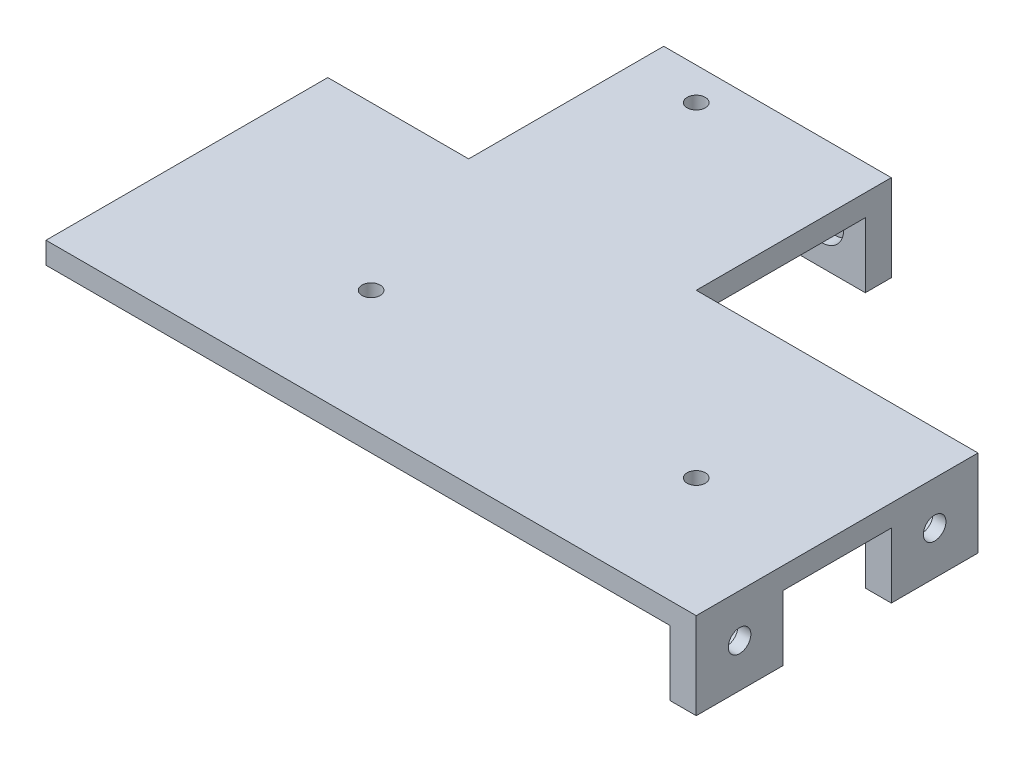
from build123d import *
from build123d.topology import SkipClean

# Parameters (mm, degrees)
SKETCH_1_R          = 2.1
EXTRUDE_1_DEPTH     = 5
SKETCH_2_W          = 20
SKETCH_2_H          = 20
SKETCH_2_R          = 2.6
EXTRUDE_2_DEPTH     = 6
SKETCH_3_R          = 5
CUT_EXTRUDE_1_DEPTH = 3
SKETCH_5_W          = 20
SKETCH_5_H          = 20
SKETCH_5_R          = 2.6
EXTRUDE_3_DEPTH     = 6
SKETCH_6_R          = 5
CUT_EXTRUDE_2_DEPTH = 3
SKETCH_7_W          = 20
SKETCH_7_H          = 20
SKETCH_7_R          = 2.6
EXTRUDE_4_DEPTH     = 6
SKETCH_8_R          = 5
CUT_EXTRUDE_3_DEPTH = 3
EXTRUDE_START       = 7.6
SKETCH_9_R          = 5
SKETCH_9_R_2        = 2.1
EXTRUDE_5_DEPTH     = 7.6
EXTRUDE_START_2     = 2.5
SKETCH_10_R         = 5
SKETCH_10_R_2       = 3.95
EXTRUDE_6_DEPTH     = 2.5


with BuildPart() as part:
    # 草图1 → 凸台-拉伸1 (new body)
    with BuildSketch(Plane(origin=(0, 0, 0), x_dir=(1, 0, 0), z_dir=(0, 1, 0))):
        Polygon((0, -65), (0, -130), (150, -130), (150, -65), (85, -65), (85, -20), (32.5, -20), (32.5, -65), align=None)
        with Locations(Location((47.5, -27.5, 0), (0, 0, 270))):
            Circle(SKETCH_1_R, mode=Mode.SUBTRACT)
        with Locations(Location((47.5, -102.5, 0), (0, 0, 270))):
            Circle(SKETCH_1_R, mode=Mode.SUBTRACT)
        with Locations(Location((122.5, -102.5, 0), (0, 0, 270))):
            Circle(SKETCH_1_R, mode=Mode.SUBTRACT)
    extrude(amount=EXTRUDE_1_DEPTH)

    # 草图2 → 凸台-拉伸2 (add)
    with BuildSketch(Plane(origin=(150, 0, 0), x_dir=(0, 0, -1), z_dir=(1, 0, 0))):
        with Locations((-75, -5)):
            Rectangle(SKETCH_2_W, SKETCH_2_H)
        with Locations((-75, -5)):
            Circle(SKETCH_2_R, mode=Mode.SUBTRACT)
    extrude(amount=-EXTRUDE_2_DEPTH)

    # 草图3 → 切除-拉伸1 (cut)
    with BuildSketch(Plane.ZY.offset(-144)):
        with Locations((75, -5)):
            Circle(SKETCH_3_R)
    extrude(amount=-CUT_EXTRUDE_1_DEPTH, mode=Mode.SUBTRACT)

    # 草图5 → 凸台-拉伸3 (add)
    with BuildSketch(Plane(origin=(0, 0, 20), x_dir=(-1, 0, 0), z_dir=(0, 0, -1))):
        with Locations((-75, -5)):
            Rectangle(SKETCH_5_W, SKETCH_5_H)
        with Locations((-75, -5)):
            Circle(SKETCH_5_R, mode=Mode.SUBTRACT)
    extrude(amount=-EXTRUDE_3_DEPTH)

    # 草图6 → 切除-拉伸2 (cut)
    with BuildSketch(Plane.XY.offset(26)):
        with Locations((75, -5)):
            Circle(SKETCH_6_R)
    extrude(amount=-CUT_EXTRUDE_2_DEPTH, mode=Mode.SUBTRACT)

    # 草图7 → 凸台-拉伸4 (add)
    with BuildSketch(Plane(origin=(150, 0, 0), x_dir=(0, 0, -1), z_dir=(1, 0, 0))):
        with Locations((-120, -5)):
            Rectangle(SKETCH_7_W, SKETCH_7_H)
        with Locations((-120, -5)):
            Circle(SKETCH_7_R, mode=Mode.SUBTRACT)
    extrude(amount=-EXTRUDE_4_DEPTH)

    # 草图8 → 切除-拉伸3 (cut)
    with BuildSketch(Plane.ZY.offset(-144)):
        with Locations((120, -5)):
            Circle(SKETCH_8_R)
    extrude(amount=-CUT_EXTRUDE_3_DEPTH, mode=Mode.SUBTRACT)

    # 草图9 → 凸台-拉伸5 (add)
    # profile 1 of 3: a face of its own
    with SkipClean():  # the faces are left unmerged after this step: merging them gives an invalid solid
        with BuildSketch(Plane.XZ.offset(EXTRUDE_START)):
            with Locations(Location((47.5, 102.5, 0), (0, 0, 90))):
                Circle(SKETCH_9_R)
            with Locations(Location((47.5, 102.5, 0), (0, 0, 270))):
                Circle(SKETCH_9_R_2, mode=Mode.SUBTRACT)
        # profile 2 of 3: a face of its own
        with BuildSketch(Plane.XZ.offset(EXTRUDE_START)):
            with Locations(Location((122.5, 102.5, 0), (0, 0, 90))):
                Circle(SKETCH_9_R)
            with Locations(Location((122.5, 102.5, 0), (0, 0, 270))):
                Circle(SKETCH_9_R_2, mode=Mode.SUBTRACT)
        # profile 3 of 3: a face of its own
        with BuildSketch(Plane.XZ.offset(EXTRUDE_START)):
            with Locations(Location((47.5, 27.5, 0), (0, 0, 90))):
                Circle(SKETCH_9_R)
            with Locations(Location((47.5, 27.5, 0), (0, 0, 270))):
                Circle(SKETCH_9_R_2, mode=Mode.SUBTRACT)
        extrude(amount=-EXTRUDE_5_DEPTH)

    # 草图10 → 凸台-拉伸6 (add)
    # profile 1 of 3: a face of its own
    with SkipClean():  # the faces are left unmerged after this step: merging them gives an invalid solid
        with BuildSketch(Plane.XZ.offset(7.6).offset(EXTRUDE_START_2)):
            with Locations(Location((47.5, 102.5, 0), (0, 0, 90))):
                Circle(SKETCH_10_R)
            with Locations(Location((47.5, 102.5, 0), (0, 0, 270))):
                Circle(SKETCH_10_R_2, mode=Mode.SUBTRACT)
        # profile 2 of 3: a face of its own
        with BuildSketch(Plane.XZ.offset(7.6).offset(EXTRUDE_START_2)):
            with Locations(Location((47.5, 27.5, 0), (0, 0, 90))):
                Circle(SKETCH_10_R)
            with Locations(Location((47.5, 27.5, 0), (0, 0, 270))):
                Circle(SKETCH_10_R_2, mode=Mode.SUBTRACT)
        # profile 3 of 3: a face of its own
        with BuildSketch(Plane.XZ.offset(7.6).offset(EXTRUDE_START_2)):
            with Locations(Location((122.5, 102.5, 0), (0, 0, 90))):
                Circle(SKETCH_10_R)
            with Locations(Location((122.5, 102.5, 0), (0, 0, 270))):
                Circle(SKETCH_10_R_2, mode=Mode.SUBTRACT)
        extrude(amount=-EXTRUDE_6_DEPTH)


solid = part.part
